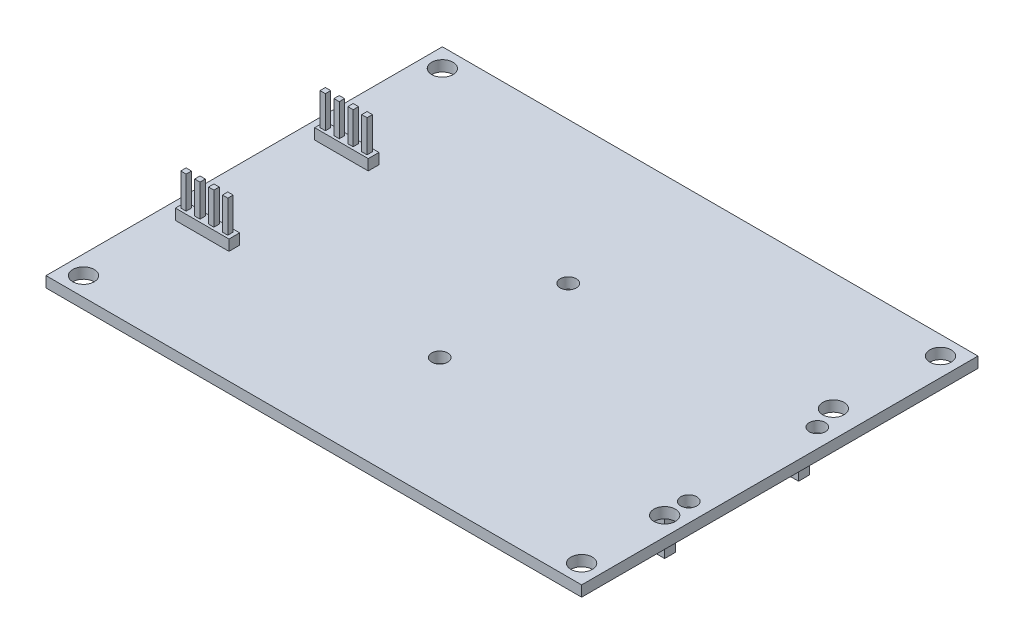
from build123d import *

# Parameters (mm, degrees)
SKETCH1_W           = 100
SKETCH1_H           = 74
SKETCH1_R           = 2
SKETCH1_R_2         = 1.5
BOSS_EXTRUDE1_DEPTH = 2
SKETCH2_W           = 10
SKETCH2_H           = 2
BOSS_EXTRUDE2_DEPTH = 2
SKETCH3_W           = 41
SKETCH3_H           = 2
SKETCH3_W_2         = 1
SKETCH3_H_2         = 1
BOSS_EXTRUDE4_DEPTH = 8
SKETCH4_W           = 1
SKETCH4_H           = 1
BOSS_EXTRUDE5_DEPTH = 8


with BuildPart() as part:
    # Sketch1 → Boss-Extrude1 (new body)
    with BuildSketch(Plane(origin=(0, 0, 0), x_dir=(1, 0, 0), z_dir=(0, 1, 0))):
        Rectangle(SKETCH1_W, SKETCH1_H)
        with Locations(Location((-46.5, 33.5, 0), (0, 0, 270))):
            Circle(SKETCH1_R, mode=Mode.SUBTRACT)
        with Locations(Location((46.5, 33.5, 0), (0, 0, 90))):
            Circle(SKETCH1_R, mode=Mode.SUBTRACT)
        with Locations(Location((46.5, -33.5, 0), (0, 0, 270))):
            Circle(SKETCH1_R, mode=Mode.SUBTRACT)
        with Locations(Location((-46.5, -33.5, 0), (0, 0, 90))):
            Circle(SKETCH1_R, mode=Mode.SUBTRACT)
        with Locations(Location((46.5, -18, 0), (0, 0, 270))):
            Circle(SKETCH1_R, mode=Mode.SUBTRACT)
        with Locations(Location((45, 15, 0), (0, 0, 270))):
            Circle(SKETCH1_R, mode=Mode.SUBTRACT)
        with Locations(Location((0, 10.5, 0), (0, 0, 270))):
            Circle(SKETCH1_R_2, mode=Mode.SUBTRACT)
        with Locations(Location((46.5, 10.5, 0), (0, 0, 270))):
            Circle(SKETCH1_R_2, mode=Mode.SUBTRACT)
        with Locations(Location((46.5, -13.5, 0), (0, 0, 90))):
            Circle(SKETCH1_R_2, mode=Mode.SUBTRACT)
        with Locations(Location((0, -13.5, 0), (0, 0, 90))):
            Circle(SKETCH1_R_2, mode=Mode.SUBTRACT)
    extrude(amount=BOSS_EXTRUDE1_DEPTH)

    # Sketch2 → Boss-Extrude2 (add)
    with BuildSketch(Plane(origin=(0, 2, 0), x_dir=(1, 0, 0), z_dir=(0, 1, 0))):
        with Locations((-41.839490028, 11)):
            Rectangle(SKETCH2_W, SKETCH2_H)
        with Locations((-41.839490028, -15)):
            Rectangle(SKETCH2_W, SKETCH2_H)
    extrude(amount=BOSS_EXTRUDE2_DEPTH)

    # Sketch3 → Boss-Extrude4 (add)
    # profile 1 of 2: a face of its own
    with BuildSketch(Plane.XZ):
        with Locations((23, 14)):
            Rectangle(SKETCH3_W, SKETCH3_H)
        with Locations((3.5, 14)):
            Rectangle(SKETCH3_W_2, SKETCH3_H_2, mode=Mode.SUBTRACT)
        with Locations((6.0925, 14)):
            Rectangle(SKETCH3_W_2, SKETCH3_H_2, mode=Mode.SUBTRACT)
        with Locations((8.685, 14)):
            Rectangle(SKETCH3_W_2, SKETCH3_H_2, mode=Mode.SUBTRACT)
        with Locations((11.2775, 14)):
            Rectangle(SKETCH3_W_2, SKETCH3_H_2, mode=Mode.SUBTRACT)
        with Locations((13.87, 14)):
            Rectangle(SKETCH3_W_2, SKETCH3_H_2, mode=Mode.SUBTRACT)
        with Locations((16.4625, 14)):
            Rectangle(SKETCH3_W_2, SKETCH3_H_2, mode=Mode.SUBTRACT)
        with Locations((19.055, 14)):
            Rectangle(SKETCH3_W_2, SKETCH3_H_2, mode=Mode.SUBTRACT)
        with Locations((21.6475, 14)):
            Rectangle(SKETCH3_W_2, SKETCH3_H_2, mode=Mode.SUBTRACT)
        with Locations((24.24, 14)):
            Rectangle(SKETCH3_W_2, SKETCH3_H_2, mode=Mode.SUBTRACT)
        with Locations((26.8325, 14)):
            Rectangle(SKETCH3_W_2, SKETCH3_H_2, mode=Mode.SUBTRACT)
        with Locations((29.425, 14)):
            Rectangle(SKETCH3_W_2, SKETCH3_H_2, mode=Mode.SUBTRACT)
        with Locations((32.0175, 14)):
            Rectangle(SKETCH3_W_2, SKETCH3_H_2, mode=Mode.SUBTRACT)
        with Locations((34.61, 14)):
            Rectangle(SKETCH3_W_2, SKETCH3_H_2, mode=Mode.SUBTRACT)
        with Locations((37.2025, 14)):
            Rectangle(SKETCH3_W_2, SKETCH3_H_2, mode=Mode.SUBTRACT)
        with Locations((39.795, 14)):
            Rectangle(SKETCH3_W_2, SKETCH3_H_2, mode=Mode.SUBTRACT)
        with Locations((42.3875, 14)):
            Rectangle(SKETCH3_W_2, SKETCH3_H_2, mode=Mode.SUBTRACT)
    # profile 2 of 2: a face of its own
    with BuildSketch(Plane.XZ):
        with Locations((23, -11)):
            Rectangle(SKETCH3_W, SKETCH3_H)
        with Locations((42.3875, -11)):
            Rectangle(SKETCH3_W_2, SKETCH3_H_2, mode=Mode.SUBTRACT)
        with Locations((39.795, -11)):
            Rectangle(SKETCH3_W_2, SKETCH3_H_2, mode=Mode.SUBTRACT)
        with Locations((37.2025, -11)):
            Rectangle(SKETCH3_W_2, SKETCH3_H_2, mode=Mode.SUBTRACT)
        with Locations((34.61, -11)):
            Rectangle(SKETCH3_W_2, SKETCH3_H_2, mode=Mode.SUBTRACT)
        with Locations((32.0175, -11)):
            Rectangle(SKETCH3_W_2, SKETCH3_H_2, mode=Mode.SUBTRACT)
        with Locations((29.425, -11)):
            Rectangle(SKETCH3_W_2, SKETCH3_H_2, mode=Mode.SUBTRACT)
        with Locations((26.8325, -11)):
            Rectangle(SKETCH3_W_2, SKETCH3_H_2, mode=Mode.SUBTRACT)
        with Locations((24.24, -11)):
            Rectangle(SKETCH3_W_2, SKETCH3_H_2, mode=Mode.SUBTRACT)
        with Locations((21.6475, -11)):
            Rectangle(SKETCH3_W_2, SKETCH3_H_2, mode=Mode.SUBTRACT)
        with Locations((19.055, -11)):
            Rectangle(SKETCH3_W_2, SKETCH3_H_2, mode=Mode.SUBTRACT)
        with Locations((16.4625, -11)):
            Rectangle(SKETCH3_W_2, SKETCH3_H_2, mode=Mode.SUBTRACT)
        with Locations((13.87, -11)):
            Rectangle(SKETCH3_W_2, SKETCH3_H_2, mode=Mode.SUBTRACT)
        with Locations((11.2775, -11)):
            Rectangle(SKETCH3_W_2, SKETCH3_H_2, mode=Mode.SUBTRACT)
        with Locations((8.685, -11)):
            Rectangle(SKETCH3_W_2, SKETCH3_H_2, mode=Mode.SUBTRACT)
        with Locations((6.0925, -11)):
            Rectangle(SKETCH3_W_2, SKETCH3_H_2, mode=Mode.SUBTRACT)
        with Locations((3.5, -11)):
            Rectangle(SKETCH3_W_2, SKETCH3_H_2, mode=Mode.SUBTRACT)
    extrude(amount=BOSS_EXTRUDE4_DEPTH)

    # Sketch4 → Boss-Extrude5 (add)
    with BuildSketch(Plane(origin=(0, 2, 0), x_dir=(1, 0, 0), z_dir=(0, 1, 0))):
        with Locations((-45.839490028, 11)):
            Rectangle(SKETCH4_W, SKETCH4_H)
        with Locations((-43.246990028, 11)):
            Rectangle(SKETCH4_W, SKETCH4_H)
        with Locations((-40.654490028, 11)):
            Rectangle(SKETCH4_W, SKETCH4_H)
        with Locations((-38.061990028, 11)):
            Rectangle(SKETCH4_W, SKETCH4_H)
        with Locations((-38.061990028, -15)):
            Rectangle(SKETCH4_W, SKETCH4_H)
        with Locations((-40.654490028, -15)):
            Rectangle(SKETCH4_W, SKETCH4_H)
        with Locations((-43.246990028, -15)):
            Rectangle(SKETCH4_W, SKETCH4_H)
        with Locations((-45.839490028, -15)):
            Rectangle(SKETCH4_W, SKETCH4_H)
    extrude(amount=BOSS_EXTRUDE5_DEPTH)


solid = part.part
